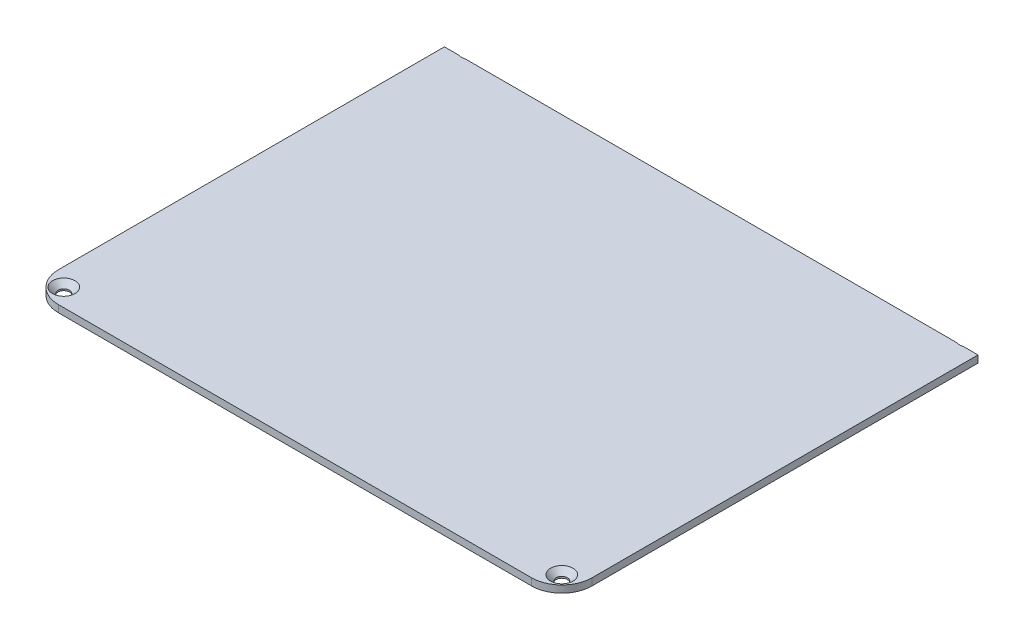
from build123d import *

# Parameters (mm, degrees)
SKIZZE1_W                                   = 300
SKIZZE1_H                                   = 234
AUFSATZ_LINEAR_AUSTRAGEN1_DEPTH             = 4
VERRUNDUNG1_R                               = 17
FORMSENKUNG_F_R_M6_SENKSCHRAUBE_MIT_2_COUNT = 2
FORMSENKUNG_F_R_M6_SENKSCHRAUBE_MIT_2_PITCH = 280
FORMSENKUNG_F_R_M6_SENKSCHRAUBE_MIT_3_COUNT = 2
FORMSENKUNG_F_R_M6_SENKSCHRAUBE_MIT_3_PITCH = 362.35341864
FORMSENKUNG_F_R_M6_SENKSCHRAUBE_MIT_4_COUNT = 2
FORMSENKUNG_F_R_M6_SENKSCHRAUBE_MIT_4_PITCH = 230


with BuildPart() as part:
    # Skizze1 → Aufsatz-Linear austragen1 (new body)
    with BuildSketch(Plane(origin=(0, 0, 0), x_dir=(1, 0, 0), z_dir=(0, 1, 0))):
        with Locations((150, 117)):
            Rectangle(SKIZZE1_W, SKIZZE1_H)
    extrude(amount=AUFSATZ_LINEAR_AUSTRAGEN1_DEPTH)

    # Verrundung1
    verrundung1_edges = [part.edges().sort_by_distance(p)[0] for p in [
        (300, 2, 0),
        (0, 2, 0),
    ]]
    fillet(verrundung1_edges, radius=VERRUNDUNG1_R)

    # Skizze2 → Formsenkung für M6 Senkschraube mit Schlitz/Kreuzschlitz1 (revolve, cut)
    with BuildSketch(Plane(origin=(10, 4, -10), x_dir=(0, 0, 1), z_dir=(1, 0, 0))):
        Polygon((0, 0), (0, 4), (3.2, 4), (3.2, 3.1), (6.3, 0), align=None)
    formsenkung_f_r_m6_senkschraube_mit_schl = revolve(axis=Axis((10, 10.35, -10), (0, -1, 0)), mode=Mode.SUBTRACT)

    # Formsenkung f_r M6 Senkschraube mit  2: Formsenkung für M6 Senkschraube mit Schlitz/Kreuzschlitz1 ×2
    with Locations(*[(i * FORMSENKUNG_F_R_M6_SENKSCHRAUBE_MIT_2_PITCH, 0, 0) for i in range(1, FORMSENKUNG_F_R_M6_SENKSCHRAUBE_MIT_2_COUNT)]):
        add(formsenkung_f_r_m6_senkschraube_mit_schl, mode=Mode.SUBTRACT)

    # Formsenkung f_r M6 Senkschraube mit  3: Formsenkung für M6 Senkschraube mit Schlitz/Kreuzschlitz1 ×2
    with Locations(*[Vector(0.7727262545252342, 0, -0.6347394233600139) * (i * FORMSENKUNG_F_R_M6_SENKSCHRAUBE_MIT_3_PITCH) for i in range(1, FORMSENKUNG_F_R_M6_SENKSCHRAUBE_MIT_3_COUNT)]):
        add(formsenkung_f_r_m6_senkschraube_mit_schl, mode=Mode.SUBTRACT)

    # Formsenkung f_r M6 Senkschraube mit  4: Formsenkung für M6 Senkschraube mit Schlitz/Kreuzschlitz1 ×2
    with Locations(*[(0, 0, -i * FORMSENKUNG_F_R_M6_SENKSCHRAUBE_MIT_4_PITCH) for i in range(1, FORMSENKUNG_F_R_M6_SENKSCHRAUBE_MIT_4_COUNT)]):
        add(formsenkung_f_r_m6_senkschraube_mit_schl, mode=Mode.SUBTRACT)


solid = part.part
